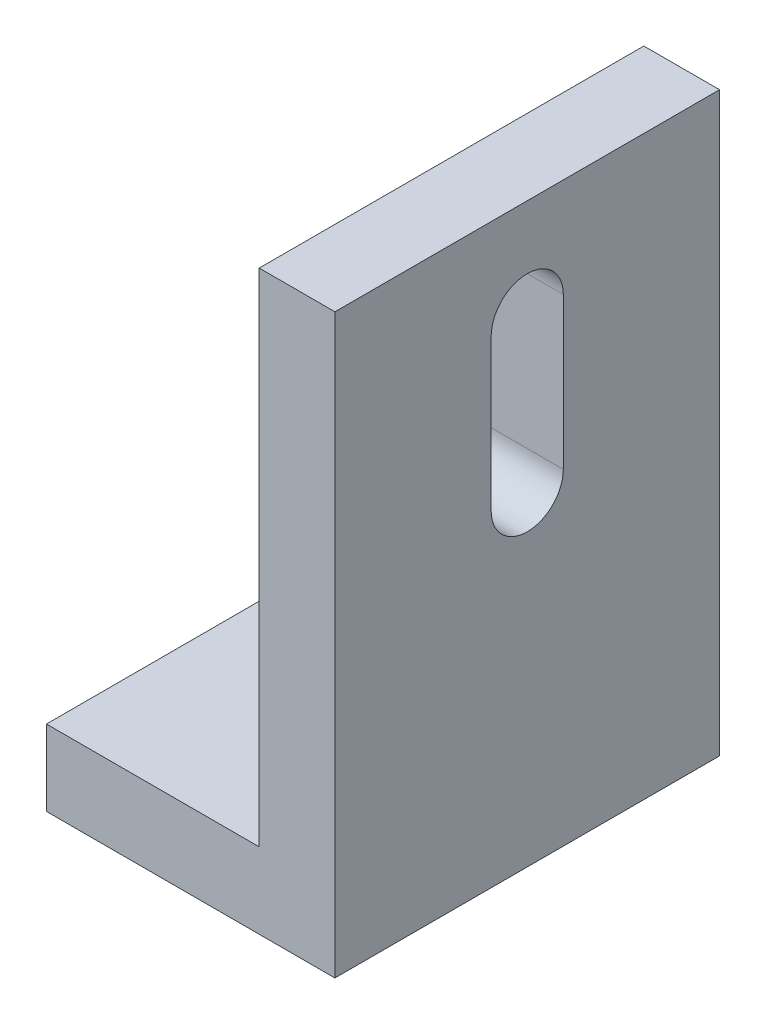
from build123d import *

# Parameters (mm, degrees)
EXTRUIR_L_MINA1_DEPTH = 25.4
CROQUIS2_R            = 4.7625
CORTAR_EXTRUIR1_DEPTH = 81.493540113
CORTAR_EXTRUIR2_DEPTH = 10


with BuildPart() as part:
    # Croquis1 → Extruir-Lámina1 (new, symmetric)
    with BuildSketch(Plane.XY):
        Polygon((0, 0), (38.1, 0), (38.1, 76.2), (28.1, 76.2), (28.1, 10), (0, 10), align=None)
    extrude(amount=EXTRUIR_L_MINA1_DEPTH, both=True)

    # Croquis2 → Cortar-Extruir1 (cut, through all)
    with BuildSketch(Plane(origin=(0, 10, 0), x_dir=(1, 0, 0), z_dir=(0, 1, 0))):
        with Locations(Location((14.05, 0, 0), (0, 0, 270))):
            Circle(CROQUIS2_R)
    extrude(amount=-CORTAR_EXTRUIR1_DEPTH, mode=Mode.SUBTRACT)

    # Croquis3 → Cortar-Extruir2 (cut)
    with BuildSketch(Plane.ZY.offset(-28.1)):
        with BuildLine():
            Line((-4.7625, 43.1), (-4.7625, 63.1))
            ThreePointArc((-4.7625, 63.1), (0, 67.8625), (4.7625, 63.1))
            Line((4.7625, 63.1), (4.7625, 43.1))
            ThreePointArc((4.7625, 43.1), (0, 38.3375), (-4.7625, 43.1))
        make_face()
    extrude(amount=-CORTAR_EXTRUIR2_DEPTH, mode=Mode.SUBTRACT)


solid = part.part
